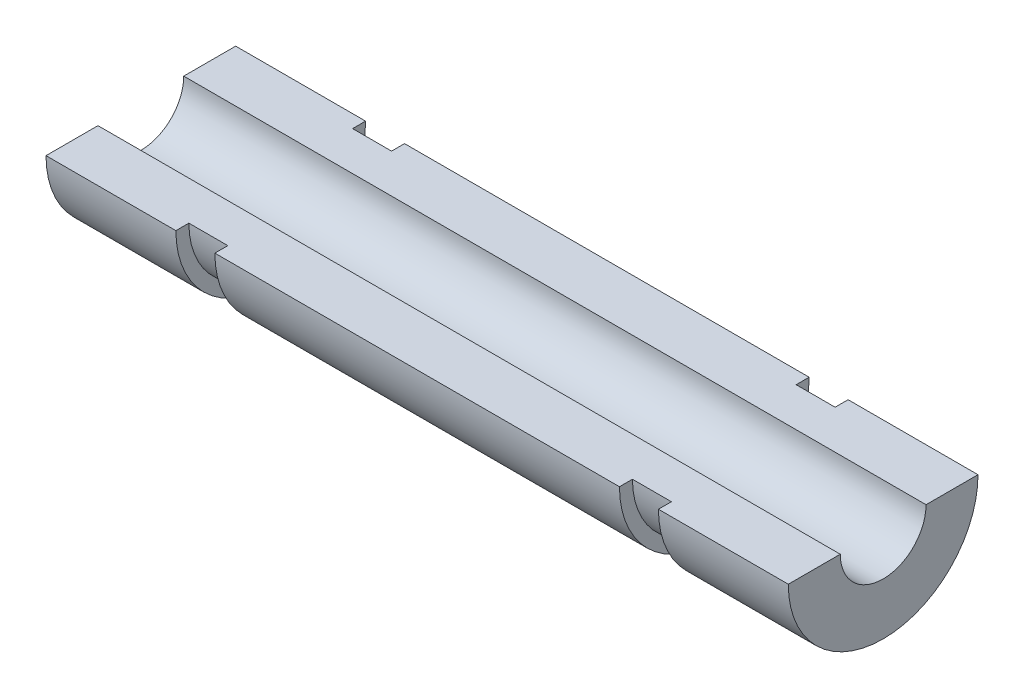
from build123d import *

# Parameters (mm, degrees)
REVOLVE1_ANGLE = 180


with BuildPart() as part:
    # Sketch2 → Revolve1 (revolve)
    with BuildSketch(Plane(origin=(0, 0, 0), x_dir=(1, 0, 0), z_dir=(0, 1, 0))):
        Polygon((-28.575, -3.302), (28.575, -3.302), (28.575, -7.302), (18.575, -7.302), (18.575, -6.302), (15.575, -6.302), (15.575, -7.302), (-15.575, -7.302), (-15.575, -6.302), (-18.575, -6.302), (-18.575, -7.302), (-28.575, -7.302), align=None)
    revolve(axis=Axis((-28.575, 0, 0), (1, 0, 0)), revolution_arc=REVOLVE1_ANGLE)


solid = part.part
